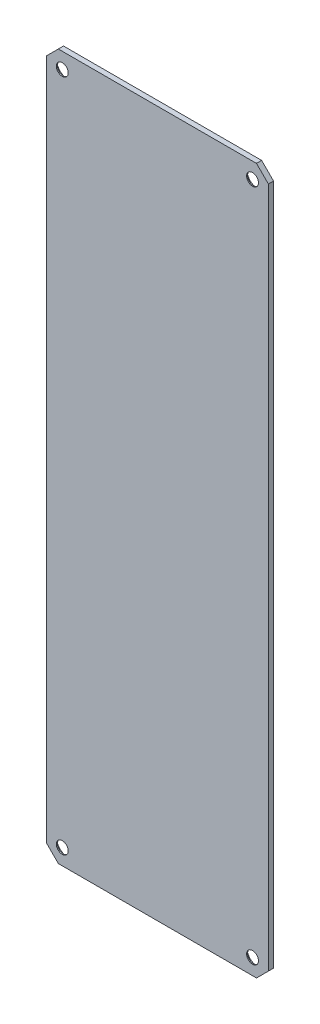
from build123d import *

# Parameters (mm, degrees)
BOSS_EXTRUDE1_DEPTH = 1.3
SKETCH4_R           = 2.667
CUT_EXTRUDE1_DEPTH  = 2
SKETCH5_R           = 2.667
SKETCH5_R_2         = 1.5
BOSS_EXTRUDE2_DEPTH = 0.254


with BuildPart() as part:
    # Sketch2 → Boss-Extrude1 (new body)
    with BuildSketch(Plane.XY):
        Polygon((0, 175), (3, 178), (53, 178), (56, 175), (56, 3), (53, 0), (3, 0), (0, 3), align=None)
    extrude(amount=BOSS_EXTRUDE1_DEPTH)

    # Sketch4 → Cut-Extrude1 (cut)
    with BuildSketch(Plane.XY.offset(1.3)):
        with Locations((4, 174)):
            Circle(SKETCH4_R)
        with Locations(Location((52, 174, 0), (0, 0, 180))):
            Circle(SKETCH4_R)
        with Locations((52, 4)):
            Circle(SKETCH4_R)
        with Locations(Location((4, 4, 0), (0, 0, 180))):
            Circle(SKETCH4_R)
    extrude(amount=-CUT_EXTRUDE1_DEPTH, mode=Mode.SUBTRACT)

    # Sketch5 → Boss-Extrude2 (add)
    # profile 1 of 4: a face of its own
    with BuildSketch(Plane.XY.offset(1.3)):
        with Locations((4, 174)):
            Circle(SKETCH5_R)
        with Locations((4, 174)):
            Circle(SKETCH5_R_2, mode=Mode.SUBTRACT)
    # profile 2 of 4: a face of its own
    with BuildSketch(Plane.XY.offset(1.3)):
        with Locations(Location((52, 174, 0), (0, 0, 180))):
            Circle(SKETCH5_R)
        with Locations(Location((52, 174, 0), (0, 0, 180))):
            Circle(SKETCH5_R_2, mode=Mode.SUBTRACT)
    # profile 3 of 4: a face of its own
    with BuildSketch(Plane.XY.offset(1.3)):
        with Locations((52, 4)):
            Circle(SKETCH5_R)
        with Locations((52, 4)):
            Circle(SKETCH5_R_2, mode=Mode.SUBTRACT)
    # profile 4 of 4: a face of its own
    with BuildSketch(Plane.XY.offset(1.3)):
        with Locations(Location((4, 4, 0), (0, 0, 180))):
            Circle(SKETCH5_R)
        with Locations(Location((4, 4, 0), (0, 0, 180))):
            Circle(SKETCH5_R_2, mode=Mode.SUBTRACT)
    extrude(amount=-BOSS_EXTRUDE2_DEPTH)


solid = part.part
